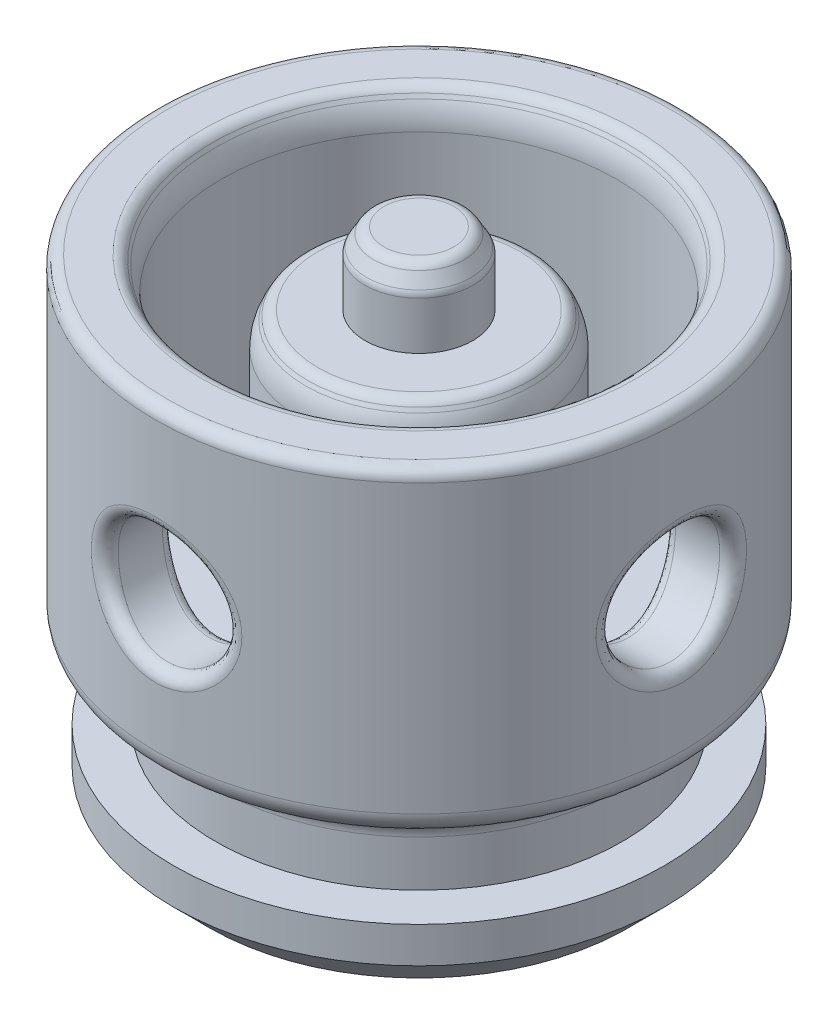
from build123d import *
from OCP.BRepFilletAPI import BRepFilletAPI_MakeChamfer

# Parameters (mm, degrees)
FASE1_SIZE                           = 1.5
SCHNITT_LINEAR_AUSTRAGEN2_REACH      = 33.702
SCHNITT_LINEAR_AUSTRAGEN2_END_RADIUS = 8.25
SKIZZE4_R                            = 2.5
KREISMUSTER1_COUNT                   = 2
KREISMUSTER1_ANGLE                   = 90
FASE2_SIZE                           = 0.5
FASE2_SIZE2                          = 0.866025404
VERRUNDUNG4_R                        = 2
VERRUNDUNG5_R                        = 1
VERRUNDUNG6_R                        = 0.5
SKIZZE3_R                            = 2.25
AUFSATZ_LINEAR_AUSTRAGEN1_DEPTH      = 3
FASE3_SIZE                           = 0.5
FASE3_SIZE2                          = 0.866025404
VERRUNDUNG7_R                        = 0.5
VERRUNDUNG8_R                        = 0.5


with BuildPart() as part:
    # Skizze1 → Rotation1 (revolve)
    with BuildSketch(Plane.XY, mode=Mode.PRIVATE) as rotation1_sk:
        Polygon((0, 18), (5, 18), (5, 8), (8.25, 8), (8.25, 20), (11, 20), (11, 6.943375673), (8.5, 5.5), (8.5, 3), (10.25, 3), (10.25, 0), (0, 0), align=None)
    revolve(rotation1_sk.sketch.rotate(Axis((0, 0, 0), (0, 1, 0)), 90), axis=Axis((0, 0, 0), (0, 1, 0)))

    # Fase1
    fase1_edges = [part.edges().sort_by_distance(p)[0] for p in [
        (0, 0, 10.25),
    ]]
    chamfer(fase1_edges, length=FASE1_SIZE)

    # Schnitt-Linear austragen2: up to this cylinder (the profile starts outside it)
    schnitt_linear_austragen2_end = Plane(origin=(0, 13, 0), z_dir=(0, -1, 0)) * Cylinder(SCHNITT_LINEAR_AUSTRAGEN2_END_RADIUS, 84.904, mode=Mode.PRIVATE)
    # Skizze4 → Schnitt-Linear austragen2 (cut, up to the surface)
    with BuildSketch(Plane(origin=(11, 0, 0), x_dir=(0, 0, -1), z_dir=(1, 0, 0)), mode=Mode.PRIVATE) as schnitt_linear_austragen2_sk1:
        with Locations((0, 13)):
            Circle(SKIZZE4_R)
    schnitt_linear_austragen2_tool1 = extrude(schnitt_linear_austragen2_sk1.sketch, amount=-SCHNITT_LINEAR_AUSTRAGEN2_REACH, mode=Mode.PRIVATE) - schnitt_linear_austragen2_end
    schnitt_linear_austragen2 = schnitt_linear_austragen2_tool1.solids().sort_by_distance((11, 13, 0))[0]
    add(schnitt_linear_austragen2, mode=Mode.SUBTRACT)

    # Kreismuster1: Schnitt-Linear austragen2 ×2 about axis
    kreismuster1_axis = Axis((0, 0, 0), (0, -1, 0))
    for i in range(1, KREISMUSTER1_COUNT):
        add(schnitt_linear_austragen2.rotate(kreismuster1_axis, i * KREISMUSTER1_ANGLE / (KREISMUSTER1_COUNT - 1)), mode=Mode.SUBTRACT)

    # Fase2: one chamfer whose edges measure the first distance from different faces: ONE call of the kernel's chamfer builder (chamfer() names one face for all edges)
    fase2_edges_1 = [part.edges().sort_by_distance(p)[0] for p in [
        (0, 20, 8.25),
    ]]
    fase2_side_1 = [part.faces().sort_by_distance(p)[0] for p in [
        (0, 20, 8.561126984),
    ]]
    fase2_edges_2 = [part.edges().sort_by_distance(p)[0] for p in [
        (0, 18, 5),
    ]]
    fase2_side_2 = [part.faces().sort_by_distance(p)[0] for p in [
        (0, 18, 0),
    ]]
    fase2 = BRepFilletAPI_MakeChamfer(part.part.solid().wrapped)
    for e in fase2_edges_1:
        fase2.Add(FASE2_SIZE, FASE2_SIZE2, e.wrapped, fase2_side_1[0].wrapped)  # the first distance lies on this face
    for e in fase2_edges_2:
        fase2.Add(FASE2_SIZE, FASE2_SIZE2, e.wrapped, fase2_side_2[0].wrapped)  # the first distance lies on this face
    add(Compound.cast(fase2.Shape()), mode=Mode.REPLACE)

    # Verrundung4
    verrundung4_edges = [part.edges().sort_by_distance(p)[0] for p in [
        (0, 19.133974596, 8.25),
        (0, 17.133974596, 5),
    ]]
    fillet(verrundung4_edges, radius=VERRUNDUNG4_R)

    # Verrundung5
    verrundung5_edges = [part.edges().sort_by_distance(p)[0] for p in [
        (0, 5.5, 8.5),
        (0, 6.943375673, 11),
    ]]
    fillet(verrundung5_edges, radius=VERRUNDUNG5_R)

    # Verrundung6
    verrundung6_edges = [part.edges().sort_by_distance(p)[0] for p in [
        (0, 20, 11),
        (0, 20, 8.75),
        (0, 18, 4.5),
    ]]
    fillet(verrundung6_edges, radius=VERRUNDUNG6_R)

    # Skizze3 → Aufsatz-Linear austragen1 (add)
    with BuildSketch(Plane(origin=(0, 18, 0), x_dir=(1, 0, 0), z_dir=(0, 1, 0))):
        with Locations(Location((0, 0, 0), (0, 0, 270))):
            Circle(SKIZZE3_R)
    extrude(amount=AUFSATZ_LINEAR_AUSTRAGEN1_DEPTH)

    # Fase3
    fase3_edges = [part.edges().sort_by_distance(p)[0] for p in [
        (0, 21, -2.25),
    ]]
    fase3_side = [part.faces().sort_by_distance(p)[0] for p in [
        (0, 21, 0),
    ]]
    chamfer(fase3_edges, length=FASE3_SIZE, length2=FASE3_SIZE2, reference=fase3_side[0])

    # Verrundung7
    verrundung7_edges = [part.edges().sort_by_distance(p)[0] for p in [
        (0, 21, -1.75),
        (0, 20.133974596, -2.25),
    ]]
    fillet(verrundung7_edges, radius=VERRUNDUNG7_R)

    # Verrundung8
    verrundung8_edges = [part.edges().sort_by_distance(p)[0] for p in [
        (7.862092603, 13, 2.500000002),
        (10.712142637, 12.999999996, 2.500000048),
        (-2.500000002, 13, 7.862092603),
        (-2.5, 13, 10.712142643),
    ]]
    fillet(verrundung8_edges, radius=VERRUNDUNG8_R)


solid = part.part
